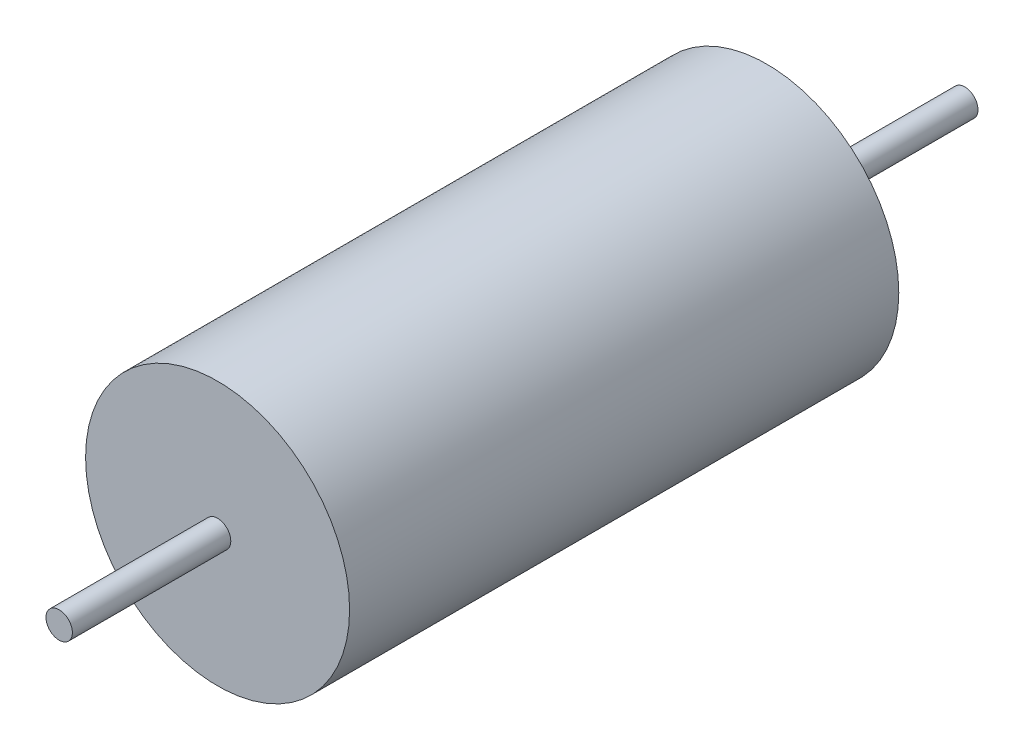
from build123d import *

# Parameters (mm, degrees)
ESBO_O3_R                = 0.5
RESSALTO_EXTRUS_O1_DEPTH = 7.5
ESBO_O4_R                = 5
RESSALTO_EXTRUS_O2_DEPTH = 20.8
ESBO_O5_R                = 0.5
RESSALTO_EXTRUS_O3_DEPTH = 6


with BuildPart() as part:
    # Esboço3 → Ressalto-extrusão1 (new body)
    with BuildSketch(Plane.XY):
        Circle(ESBO_O3_R)
    extrude(amount=RESSALTO_EXTRUS_O1_DEPTH)

    # Esboço4 → Ressalto-extrusão2 (add)
    with BuildSketch(Plane.XY.offset(7.5)):
        Circle(ESBO_O4_R)
    extrude(amount=RESSALTO_EXTRUS_O2_DEPTH)

    # Esboço5 → Ressalto-extrusão3 (add)
    with BuildSketch(Plane.XY.offset(28.3)):
        Circle(ESBO_O5_R)
    extrude(amount=RESSALTO_EXTRUS_O3_DEPTH)


solid = part.part
